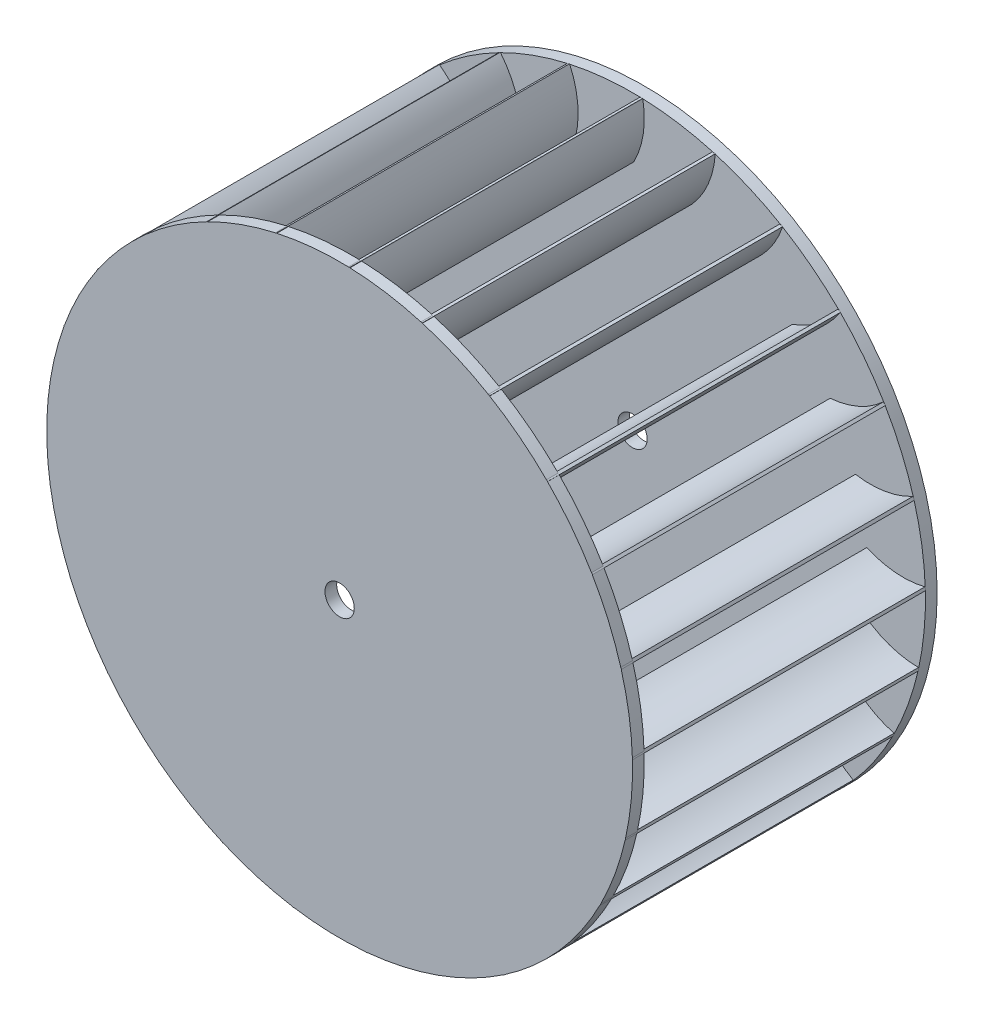
from build123d import *

# Parameters (mm, degrees)
SKETCH1_R               = 500
SKETCH1_R_2             = 25
BOSS_EXTRUDE1_DEPTH     = 20
EXTRUDE_THIN1_DEPTH     = 500
CUT_EXTRUDE1_DEPTH      = 867.158696222
CUT_EXTRUDE1_DEPTH_BACK = 500
CIRPATTERN1_COUNT       = 25
BOSS_EXTRUDE2_START     = -20
SKETCH4_R               = 500
SKETCH4_R_2             = 25
BOSS_EXTRUDE2_DEPTH     = 20


with BuildPart() as part:
    # Sketch1 → Boss-Extrude1 (new body)
    with BuildSketch(Plane.XY):
        Circle(SKETCH1_R)
        Circle(SKETCH1_R_2, mode=Mode.SUBTRACT)
    extrude(amount=BOSS_EXTRUDE1_DEPTH)

    # Sketch2 → Extrude-Thin1 (add)
    with BuildSketch(Plane.XY.offset(20)):
        with BuildLine():
            ThreePointArc((12.541917534, 499.319064948), (13.411680917, 448.888197215), (-2.216146982, 400.931968174))
            Line((-2.216146982, 400.931968174), (2.216146982, 398.617930531))
            ThreePointArc((2.216146982, 398.617930531), (18.356362681, 448.14649495), (17.458082466, 500.230833756))
            Line((17.458082466, 500.230833756), (12.541917534, 499.319064948))
        make_face()
    extrude_thin1 = extrude(amount=EXTRUDE_THIN1_DEPTH)

    # Sketch3 → Cut-Extrude1 (cut, two sides: drawn at the far end of the back side and taken through both)
    with BuildSketch(Plane(origin=(0, 0, 20), x_dir=(-1, 0, 0), z_dir=(0, 0, -1)).offset(-CUT_EXTRUDE1_DEPTH_BACK)):
        with BuildLine():
            Line((-17.557110507, 499.691652793), (-17.458082466, 500.230833756))
            ThreePointArc((-17.458082466, 500.230833756), (-17.507831073, 499.96128636), (-17.557110507, 499.691652793))
        make_face()
    extrude(amount=CUT_EXTRUDE1_DEPTH + CUT_EXTRUDE1_DEPTH_BACK, mode=Mode.SUBTRACT)

    # CirPattern1: Extrude-Thin1 ×25 about axis
    cirpattern1_axis = Axis((0, 0, 0), (0, 0, 1))
    for i in range(1, CIRPATTERN1_COUNT):
        add(extrude_thin1.rotate(cirpattern1_axis, i * 360 / CIRPATTERN1_COUNT))

    # Sketch4 → Boss-Extrude2 (add)
    with BuildSketch(Plane.XY.offset(520).offset(BOSS_EXTRUDE2_START)):
        with Locations(Location((0, 0, 0), (0, 0, 174.680868679))):
            Circle(SKETCH4_R)
        Circle(SKETCH4_R_2, mode=Mode.SUBTRACT)
    extrude(amount=BOSS_EXTRUDE2_DEPTH)


solid = part.part
